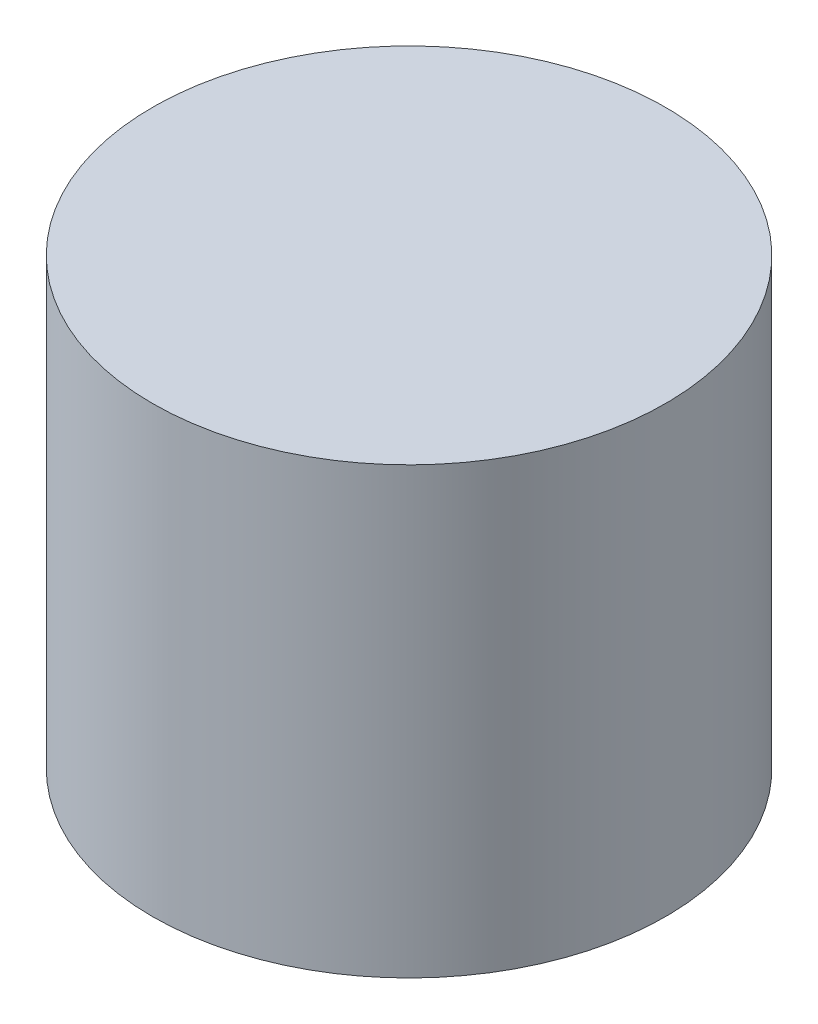
from build123d import *

# Parameters (mm, degrees)
SKETCH_1_R      = 6.35
EXTRUDE_1_DEPTH = 11


with BuildPart() as part:
    # 草图1 → 凸台-拉伸1 (new body)
    with BuildSketch(Plane(origin=(0, 0, 0), x_dir=(1, 0, 0), z_dir=(0, 1, 0))):
        with Locations(Location((0, 0, 0), (0, 0, 270))):
            Circle(SKETCH_1_R)
    extrude(amount=EXTRUDE_1_DEPTH)


solid = part.part
